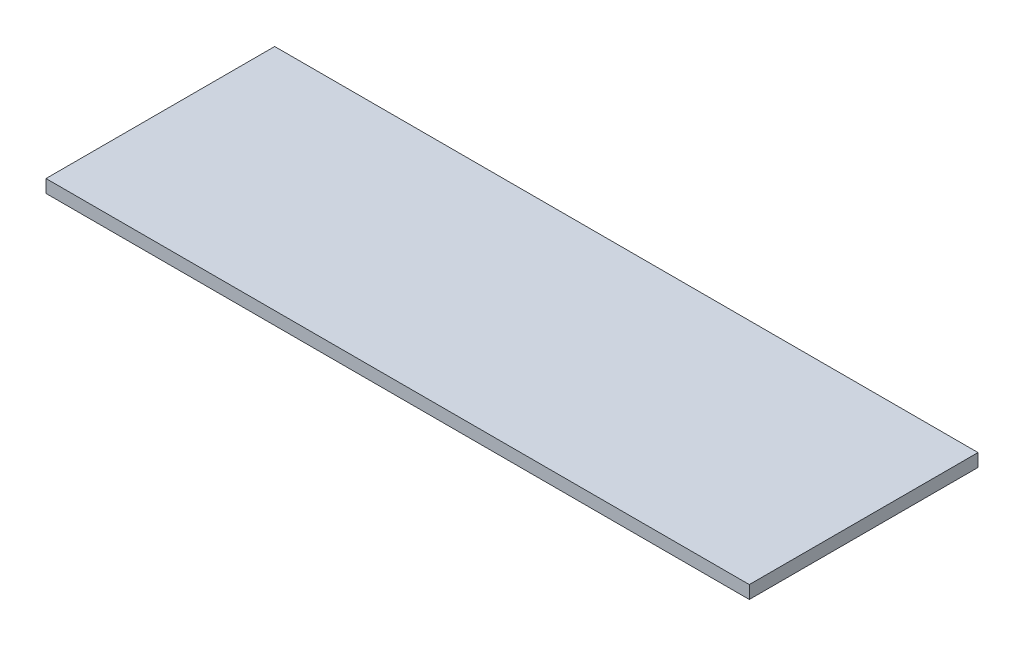
from build123d import *

# Parameters (mm, degrees)
SKETCH2_W           = 326
SKETCH2_H           = 106
BOSS_EXTRUDE1_DEPTH = 6


with BuildPart() as part:
    # Sketch2 → Boss-Extrude1 (new body)
    with BuildSketch(Plane(origin=(0, 0, 0), x_dir=(1, 0, 0), z_dir=(0, 1, 0))):
        Rectangle(SKETCH2_W, SKETCH2_H)
    extrude(amount=BOSS_EXTRUDE1_DEPTH)


solid = part.part
